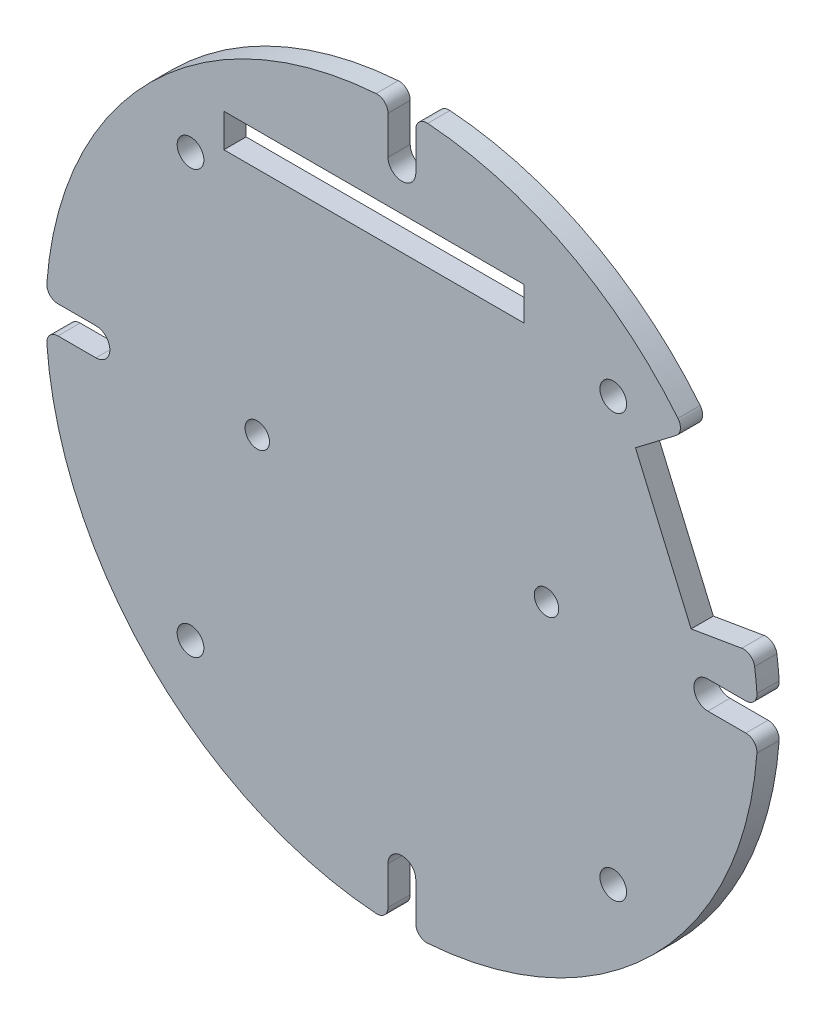
from build123d import *

# Parameters (mm, degrees)
SKETCH_1_R             = 32
EXTRUDE_1_DEPTH        = 2
SKETCH_2_R             = 1.1
CUT_EXTRUDE_1_DEPTH    = 46.299006612
HOLE_WIZARD_M2_1_D     = 2.4
HOLE_WIZARD_M2_1_DEPTH = 3.5
HOLE_WIZARD_M2_1_TIP   = 0.721032743
SKETCH_6_R             = 1.1
SKETCH_6_W             = 27
SKETCH_6_H             = 3
CUT_EXTRUDE_2_DEPTH    = 46.264500439
CUT_EXTRUDE1_DEPTH     = 10
FILLET2_R              = 1


with BuildPart() as part:
    # 스케치1 → 보스-돌출1 (new body)
    with BuildSketch(Plane.XY):
        Circle(SKETCH_1_R)
    extrude(amount=EXTRUDE_1_DEPTH)

    # 스케치2 → 컷-돌출1 (cut, through all)
    with BuildSketch(Plane.XY.offset(2)):
        with Locations((-13, 0)):
            Circle(SKETCH_2_R)
        with Locations((13, 0)):
            Circle(SKETCH_2_R)
        with BuildLine():
            Line((1.25, -27.5), (1.25, -31.975576617))
            ThreePointArc((1.25, -31.975576617), (0, -33.225576617), (-1.25, -31.975576617))
            Line((-1.25, -31.975576617), (-1.25, -27.5))
            ThreePointArc((-1.25, -27.5), (0, -26.25), (1.25, -27.5))
        make_face()
        with BuildLine():
            Line((27.5, 1.25), (32, 1.25))
            ThreePointArc((32, 1.25), (33.25, 0), (32, -1.25))
            Line((32, -1.25), (27.5, -1.25))
            ThreePointArc((27.5, -1.25), (26.25, 0), (27.5, 1.25))
        make_face()
        with BuildLine():
            Line((-27.5, -1.25), (-32, -1.25))
            ThreePointArc((-32, -1.25), (-33.25, 0), (-32, 1.25))
            Line((-32, 1.25), (-27.5, 1.25))
            ThreePointArc((-27.5, 1.25), (-26.25, 0), (-27.5, -1.25))
        make_face()
        with BuildLine():
            Line((-1.25, 27.5), (-1.25, 32))
            ThreePointArc((-1.25, 32), (0, 33.25), (1.25, 32))
            Line((1.25, 32), (1.25, 27.5))
            ThreePointArc((1.25, 27.5), (0, 26.25), (-1.25, 27.5))
        make_face()
    extrude(amount=-CUT_EXTRUDE_1_DEPTH, mode=Mode.SUBTRACT)

    # M2 여유 구멍1
    with Locations(Plane(origin=(-19, 19, 2), x_dir=(1, 0, 0), z_dir=(0, 0, 1))):
        with Locations((0, 0), (38, 0), (38, -38), (0, -38)):
            Hole(HOLE_WIZARD_M2_1_D / 2, depth=HOLE_WIZARD_M2_1_DEPTH)
            with Locations((0, 0, -(HOLE_WIZARD_M2_1_DEPTH + HOLE_WIZARD_M2_1_TIP / 2))):  # 118° drill point
                Cone(0, HOLE_WIZARD_M2_1_D / 2, HOLE_WIZARD_M2_1_TIP, mode=Mode.SUBTRACT)

    # 스케치6 → 컷-돌출2 (cut, through all)
    with BuildSketch(Plane.XY.offset(2)):
        with Locations((25, 22.2)):
            Circle(SKETCH_6_R)
        with Locations((-2.5, 22.2)):
            Rectangle(SKETCH_6_W, SKETCH_6_H)
    extrude(amount=-CUT_EXTRUDE_2_DEPTH, mode=Mode.SUBTRACT)

    # Sketch1 → Cut-Extrude1 (cut)
    with BuildSketch(Plane.XY.offset(2)):
        Polygon((21, 16), (30.255253107, 23.051621415), (39.765804764, 6.729597729), (26, 4.4), align=None)
    extrude(amount=-CUT_EXTRUDE1_DEPTH, mode=Mode.SUBTRACT)

    # Fillet2
    fillet2_edges = [part.edges().sort_by_distance(p)[0] for p in [
        (25.453815041, 19.393382888, 1),
        (31.551388335, 5.339465718, 1),
        (1.25, -31.975576617, 1),
        (-1.25, -31.975576617, 1),
        (31.975576617, 1.25, 1),
        (31.975576617, -1.25, 1),
        (-31.975576617, -1.25, 1),
        (-31.975576617, 1.25, 1),
        (-1.25, 31.975576617, 1),
        (1.25, 31.975576617, 1),
    ]]
    fillet(fillet2_edges, radius=FILLET2_R)


solid = part.part
